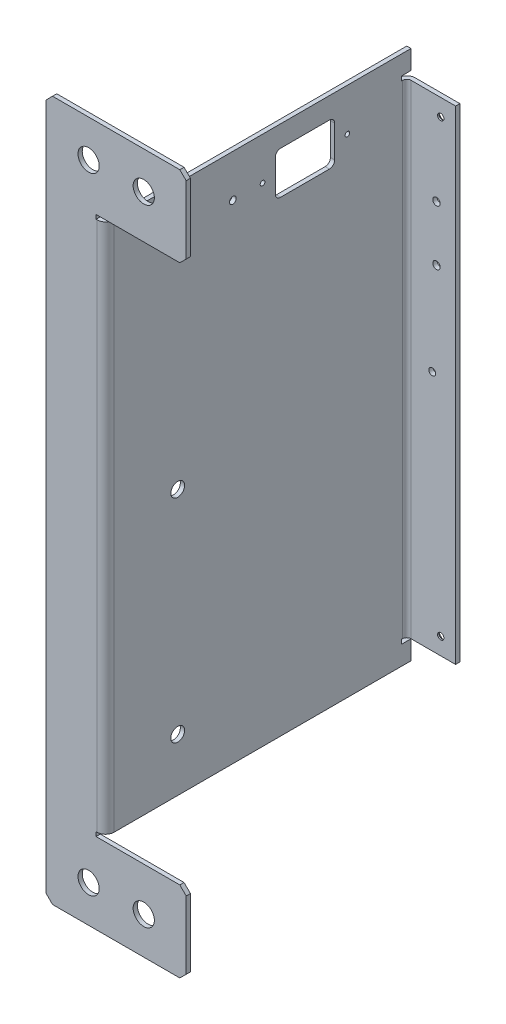
from build123d import *

# Parameters (mm, degrees)
SKETCH_1_R          = 5
EXTRUDE_1_DEPTH     = 2
SKETCH_2_W          = 2
SKETCH_2_H          = 250
EXTRUDE_2_DEPTH     = 144
SKETCH_3_W          = 2
SKETCH_3_H          = 228
EXTRUDE_3_DEPTH     = 23
SKETCH_4_W          = 4.5
SKETCH_4_H          = 2
CUT_EXTRUDE_1_DEPTH = 2
SKETCH_5_W          = 4.5
SKETCH_5_H          = 2
CUT_EXTRUDE_2_DEPTH = 2
FILLET_3_R          = 2
FILLET_4_R          = 4
SKETCH_6_R          = 1.6
SKETCH_6_R_2        = 1.5
SKETCH_6_R_3        = 1.75
CUT_EXTRUDE_3_DEPTH = 2
CHAMFER_1_SIZE      = 1.3
SKETCH_8_R          = 3.25
SKETCH_8_R_2        = 1.1
SKETCH_8_R_3        = 1.6
CUT_EXTRUDE_4_DEPTH = 2


with BuildPart() as part:
    # Эскиз1 → Вытянуть1 (new body)
    with BuildSketch(Plane.XY):
        Polygon((-15.389384289, -165), (44.610615711, -165), (47.610615711, -162), (47.610615711, -130), (44.610615711, -127), (9.610615711, -127), (9.610615711, 127), (44.610615711, 127), (47.610615711, 130), (47.610615711, 162), (44.610615711, 165), (-15.389384289, 165), (-18.389384289, 162), (-18.389384289, -162), align=None)
        with Locations((1.610615711, -147.5)):
            Circle(SKETCH_1_R, mode=Mode.SUBTRACT)
        with Locations((27.610615711, -147.5)):
            Circle(SKETCH_1_R, mode=Mode.SUBTRACT)
        with Locations(Location((27.610615711, 147.5, 0), (0, 0, 180))):
            Circle(SKETCH_1_R, mode=Mode.SUBTRACT)
        with Locations(Location((1.610615711, 147.5, 0), (0, 0, 180))):
            Circle(SKETCH_1_R, mode=Mode.SUBTRACT)
    extrude(amount=EXTRUDE_1_DEPTH)

    # Эскиз2 → Вытянуть2 (add)
    with BuildSketch(Plane.XY.offset(2)):
        with Locations((8.610615711, 0)):
            Rectangle(SKETCH_2_W, SKETCH_2_H)
    extrude(amount=-EXTRUDE_2_DEPTH)

    # Эскиз3 → Вытянуть3 (add)
    with BuildSketch(Plane(origin=(9.610615711, 0, 0), x_dir=(0, 0, -1), z_dir=(1, 0, 0))):
        with Locations((141, 0)):
            Rectangle(SKETCH_3_W, SKETCH_3_H)
    extrude(amount=EXTRUDE_3_DEPTH)

    # Эскиз4 → Вырез-Вытянуть1 (cut)
    with BuildSketch(Plane.XY.offset(2)):
        with Locations((7.360615711, 126)):
            Rectangle(SKETCH_4_W, SKETCH_4_H)
        with Locations((7.360615711, -126)):
            Rectangle(SKETCH_4_W, SKETCH_4_H)
    extrude(amount=-CUT_EXTRUDE_1_DEPTH, mode=Mode.SUBTRACT)

    # Эскиз5 → Вырез-Вытянуть2 (cut)
    with BuildSketch(Plane(origin=(9.610615711, 0, 0), x_dir=(0, 0, -1), z_dir=(1, 0, 0))):
        with Locations((139.75, -115)):
            Rectangle(SKETCH_5_W, SKETCH_5_H)
        with Locations((139.75, 115)):
            Rectangle(SKETCH_5_W, SKETCH_5_H)
    extrude(amount=-CUT_EXTRUDE_2_DEPTH, mode=Mode.SUBTRACT)

    # Скругление3
    fillet_3_edges = [part.edges().sort_by_distance(p)[0] for p in [
        (9.610615711, 0, -140),
        (7.610615711, 0, 0),
    ]]
    fillet(fillet_3_edges, radius=FILLET_3_R)

    # Скругление4
    fillet_4_edges = [part.edges().sort_by_distance(p)[0] for p in [
        (7.610615711, 0, -142),
        (9.610615711, 0, 2),
    ]]
    fillet(fillet_4_edges, radius=FILLET_4_R)

    # Эскиз6 → Вырез-Вытянуть3 (cut)
    with BuildSketch(Plane(origin=(0, 0, -142), x_dir=(-1, 0, 0), z_dir=(0, 0, -1))):
        with Locations((-21.610615711, 0)):
            Circle(SKETCH_6_R)
        with Locations((-25.610615711, -106)):
            Circle(SKETCH_6_R_2)
        with Locations((-25.610615711, 106)):
            Circle(SKETCH_6_R_2)
        with Locations((-23.610615711, 44.5)):
            Circle(SKETCH_6_R_3)
        with Locations((-23.610615711, 70.5)):
            Circle(SKETCH_6_R_3)
    extrude(amount=-CUT_EXTRUDE_3_DEPTH, mode=Mode.SUBTRACT)

    # Фаска1
    chamfer_1_edges = [part.edges().sort_by_distance(p)[0] for p in [
        (27.110615711, -106, -142),
        (27.110615711, 106, -142),
    ]]
    chamfer(chamfer_1_edges, length=CHAMFER_1_SIZE)

    # Эскиз8 → Вырез-Вытянуть4 (cut)
    with BuildSketch(Plane(origin=(9.610615711, 0, 0), x_dir=(0, 0, -1), z_dir=(1, 0, 0))):
        with Locations((32, 0)):
            Circle(SKETCH_8_R)
        with Locations((32, -100)):
            Circle(SKETCH_8_R)
        with Locations(Location((32, 100, 0), (0, 0, 180))):
            Circle(SKETCH_8_R)
        with Locations(Location((112, 105, 0), (0, 0, 180))):
            Circle(SKETCH_8_R_2)
        with Locations(Location((72, 105, 0), (0, 0, 180))):
            Circle(SKETCH_8_R_2)
        with Locations(Location((58, 105, 0), (0, 0, 180))):
            Circle(SKETCH_8_R_3)
        with BuildLine():
            Line((80.5, 95), (103.5, 95))
            ThreePointArc((103.5, 95), (105.267766953, 95.732233047), (106, 97.5))
            Line((106, 97.5), (106, 112.5))
            ThreePointArc((106, 112.5), (105.267766953, 114.267766953), (103.5, 115))
            Line((103.5, 115), (80.5, 115))
            ThreePointArc((80.5, 115), (78.732233047, 114.267766953), (78, 112.5))
            Line((78, 112.5), (78, 97.5))
            ThreePointArc((78, 97.5), (78.732233047, 95.732233047), (80.5, 95))
        make_face()
    extrude(amount=-CUT_EXTRUDE_4_DEPTH, mode=Mode.SUBTRACT)


solid = part.part
